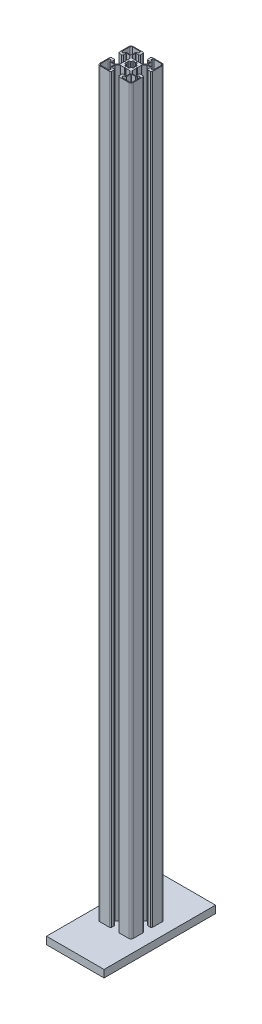
from build123d import *

# Parameters (mm, degrees)
EXTRUDE1_DEPTH      = 1000
SKETCH2_W           = 77.651056684
SKETCH2_H           = 150.32993284
BOSS_EXTRUDE1_DEPTH = 10


with BuildPart() as part:
    # Sketch1 → Extrude1 (new body)
    with BuildSketch(Plane(origin=(0, 0, 0), x_dir=(1, 0, 0), z_dir=(0, 1, 0))):
        with BuildLine():
            Line((4.905816029, 11.21531926), (4.005816103, 10.700171216))
            Line((4.005816103, 10.700171216), (3.105816176, 11.21531926))
            Line((3.105816176, 11.21531926), (-2.197508215, 11.21531926))
            ThreePointArc((-2.197508215, 11.21531926), (-2.342927919, 11.244245037), (-2.466208792, 11.326618683))
            Line((-2.466208792, 11.326618683), (-5.932884474, 14.793294365))
            ThreePointArc((-5.932884474, 14.793294365), (-6.01525812, 14.916575238), (-6.044183897, 15.061994942))
            Line((-6.044183897, 15.061994942), (-6.044183897, 19.35531926))
            ThreePointArc((-6.044183897, 19.35531926), (-5.932884474, 19.624019836), (-5.664183897, 19.73531926))
            Line((-5.664183897, 19.73531926), (-2.579183897, 19.73531926))
            ThreePointArc((-2.579183897, 19.73531926), (-1.50438159, 20.180516952), (-1.059183897, 21.25531926))
            Line((-1.059183897, 21.25531926), (-1.059183897, 24.21531926))
            ThreePointArc((-1.059183897, 24.21531926), (-1.50438159, 25.290121567), (-2.579183897, 25.73531926))
            Line((-2.579183897, 25.73531926), (-15.494183897, 25.73531926))
            ThreePointArc((-15.494183897, 25.73531926), (-17.615504241, 24.856639603), (-18.494183897, 22.73531926))
            Line((-18.494183897, 22.73531926), (-18.494183897, 9.82031926))
            ThreePointArc((-18.494183897, 9.82031926), (-18.048986205, 8.745516952), (-16.974183897, 8.30031926))
            Line((-16.974183897, 8.30031926), (-14.014183897, 8.30031926))
            ThreePointArc((-14.014183897, 8.30031926), (-12.93938159, 8.745516952), (-12.494183897, 9.82031926))
            Line((-12.494183897, 9.82031926), (-12.494183897, 12.90531926))
            ThreePointArc((-12.494183897, 12.90531926), (-12.382884474, 13.174019836), (-12.114183897, 13.28531926))
            Line((-12.114183897, 13.28531926), (-7.813788512, 13.28531926))
            ThreePointArc((-7.813788512, 13.28531926), (-7.668368808, 13.256393482), (-7.545087935, 13.174019836))
            Line((-7.545087935, 13.174019836), (-4.08548332, 9.714415222))
            ThreePointArc((-4.08548332, 9.714415222), (-4.003109675, 9.591134349), (-3.974183897, 9.445714645))
            Line((-3.974183897, 9.445714645), (-3.974183897, 4.135318895))
            Line((-3.974183897, 4.135318895), (-3.454570628, 3.23531926))
            Line((-3.454570628, 3.23531926), (-3.974183897, 2.335319624))
            Line((-3.974183897, 2.335319624), (-3.974183897, -2.968005058))
            ThreePointArc((-3.974183897, -2.968005058), (-4.003109675, -3.113424762), (-4.08548332, -3.236705635))
            Line((-4.08548332, -3.236705635), (-7.552159003, -6.703381317))
            ThreePointArc((-7.552159003, -6.703381317), (-7.675439876, -6.785754963), (-7.82085958, -6.81468074))
            Line((-7.82085958, -6.81468074), (-12.114183897, -6.81468074))
            ThreePointArc((-12.114183897, -6.81468074), (-12.382884474, -6.703381317), (-12.494183897, -6.43468074))
            Line((-12.494183897, -6.43468074), (-12.494183897, -3.34968074))
            ThreePointArc((-12.494183897, -3.34968074), (-12.93938159, -2.274878433), (-14.014183897, -1.82968074))
            Line((-14.014183897, -1.82968074), (-16.974183897, -1.82968074))
            ThreePointArc((-16.974183897, -1.82968074), (-18.048986205, -2.274878433), (-18.494183897, -3.34968074))
            Line((-18.494183897, -3.34968074), (-18.494183897, -16.26468074))
            ThreePointArc((-18.494183897, -16.26468074), (-17.615504241, -18.386001084), (-15.494183897, -19.26468074))
            Line((-15.494183897, -19.26468074), (-2.579183897, -19.26468074))
            ThreePointArc((-2.579183897, -19.26468074), (-1.50438159, -18.819483048), (-1.059183897, -17.74468074))
            Line((-1.059183897, -17.74468074), (-1.059183897, -14.78468074))
            ThreePointArc((-1.059183897, -14.78468074), (-1.50438159, -13.709878433), (-2.579183897, -13.26468074))
            Line((-2.579183897, -13.26468074), (-5.664183897, -13.26468074))
            ThreePointArc((-5.664183897, -13.26468074), (-5.932884474, -13.153381317), (-6.044183897, -12.88468074))
            Line((-6.044183897, -12.88468074), (-6.044183897, -8.584285355))
            ThreePointArc((-6.044183897, -8.584285355), (-6.01525812, -8.438865651), (-5.932884474, -8.315584778))
            Line((-5.932884474, -8.315584778), (-2.473279859, -4.855980164))
            ThreePointArc((-2.473279859, -4.855980164), (-2.349998987, -4.773606518), (-2.204579283, -4.74468074))
            Line((-2.204579283, -4.74468074), (3.105816176, -4.74468074))
            Line((3.105816176, -4.74468074), (4.005816103, -4.229532697))
            Line((4.005816103, -4.229532697), (4.905816029, -4.74468074))
            Line((4.905816029, -4.74468074), (10.20914042, -4.74468074))
            ThreePointArc((10.20914042, -4.74468074), (10.354560124, -4.773606518), (10.477840997, -4.855980164))
            Line((10.477840997, -4.855980164), (13.94451668, -8.322655846))
            ThreePointArc((13.94451668, -8.322655846), (14.026890325, -8.445936719), (14.055816103, -8.591356423))
            Line((14.055816103, -8.591356423), (14.055816103, -12.88468074))
            ThreePointArc((14.055816103, -12.88468074), (13.94451668, -13.153381317), (13.675816103, -13.26468074))
            Line((13.675816103, -13.26468074), (10.590816103, -13.26468074))
            ThreePointArc((10.590816103, -13.26468074), (9.516013795, -13.709878433), (9.070816103, -14.78468074))
            Line((9.070816103, -14.78468074), (9.070816103, -17.74468074))
            ThreePointArc((9.070816103, -17.74468074), (9.516013795, -18.819483048), (10.590816103, -19.26468074))
            Line((10.590816103, -19.26468074), (23.505816103, -19.26468074))
            ThreePointArc((23.505816103, -19.26468074), (25.627136446, -18.386001084), (26.505816103, -16.26468074))
            Line((26.505816103, -16.26468074), (26.505816103, -3.34968074))
            ThreePointArc((26.505816103, -3.34968074), (26.06061841, -2.274878433), (24.985816103, -1.82968074))
            Line((24.985816103, -1.82968074), (22.025816103, -1.82968074))
            ThreePointArc((22.025816103, -1.82968074), (20.951013795, -2.274878433), (20.505816103, -3.34968074))
            Line((20.505816103, -3.34968074), (20.505816103, -6.43468074))
            ThreePointArc((20.505816103, -6.43468074), (20.39451668, -6.703381317), (20.125816103, -6.81468074))
            Line((20.125816103, -6.81468074), (15.825420717, -6.81468074))
            ThreePointArc((15.825420717, -6.81468074), (15.680001013, -6.785754963), (15.556720141, -6.703381317))
            Line((15.556720141, -6.703381317), (12.097115526, -3.243776702))
            ThreePointArc((12.097115526, -3.243776702), (12.01474188, -3.12049583), (11.985816103, -2.975076126))
            Line((11.985816103, -2.975076126), (11.985816103, 2.335319624))
            Line((11.985816103, 2.335319624), (11.466202833, 3.23531926))
            Line((11.466202833, 3.23531926), (11.985816103, 4.135318895))
            Line((11.985816103, 4.135318895), (11.985816103, 9.438643577))
            ThreePointArc((11.985816103, 9.438643577), (12.01474188, 9.584063281), (12.097115526, 9.707344154))
            Line((12.097115526, 9.707344154), (15.563791208, 13.174019836))
            ThreePointArc((15.563791208, 13.174019836), (15.687072081, 13.256393482), (15.832491785, 13.28531926))
            Line((15.832491785, 13.28531926), (20.125816103, 13.28531926))
            ThreePointArc((20.125816103, 13.28531926), (20.39451668, 13.174019836), (20.505816103, 12.90531926))
            Line((20.505816103, 12.90531926), (20.505816103, 9.82031926))
            ThreePointArc((20.505816103, 9.82031926), (20.951013795, 8.745516952), (22.025816103, 8.30031926))
            Line((22.025816103, 8.30031926), (24.985816103, 8.30031926))
            ThreePointArc((24.985816103, 8.30031926), (26.06061841, 8.745516952), (26.505816103, 9.82031926))
            Line((26.505816103, 9.82031926), (26.505816103, 22.73531926))
            ThreePointArc((26.505816103, 22.73531926), (25.627136446, 24.856639603), (23.505816103, 25.73531926))
            Line((23.505816103, 25.73531926), (10.590816103, 25.73531926))
            ThreePointArc((10.590816103, 25.73531926), (9.516013795, 25.290121567), (9.070816103, 24.21531926))
            Line((9.070816103, 24.21531926), (9.070816103, 21.25531926))
            ThreePointArc((9.070816103, 21.25531926), (9.516013795, 20.180516952), (10.590816103, 19.73531926))
            Line((10.590816103, 19.73531926), (13.675816103, 19.73531926))
            ThreePointArc((13.675816103, 19.73531926), (13.94451668, 19.624019836), (14.055816103, 19.35531926))
            Line((14.055816103, 19.35531926), (14.055816103, 15.054923874))
            ThreePointArc((14.055816103, 15.054923874), (14.026890325, 14.90950417), (13.94451668, 14.786223298))
            Line((13.94451668, 14.786223298), (10.484912065, 11.326618683))
            ThreePointArc((10.484912065, 11.326618683), (10.361631192, 11.244245037), (10.216211488, 11.21531926))
            Line((10.216211488, 11.21531926), (4.905816029, 11.21531926))
        make_face()
        with BuildLine():
            Line((13.969837884, 21.274341041), (13.529837884, 21.274341041))
            ThreePointArc((13.529837884, 21.274341041), (12.469177713, 21.713680869), (12.029837884, 22.774341041))
            Line((12.029837884, 22.774341041), (12.029837884, 23.274341041))
            ThreePointArc((12.029837884, 23.274341041), (12.469177713, 24.335001213), (13.529837884, 24.774341041))
            Line((13.529837884, 24.774341041), (23.139837884, 24.774341041))
            ThreePointArc((23.139837884, 24.774341041), (24.752041345, 24.106544502), (25.419837884, 22.494341041))
            Line((25.419837884, 22.494341041), (25.419837884, 12.884341041))
            ThreePointArc((25.419837884, 12.884341041), (24.980498056, 11.823680869), (23.919837884, 11.384341041))
            Line((23.919837884, 11.384341041), (23.419837884, 11.384341041))
            ThreePointArc((23.419837884, 11.384341041), (22.359177713, 11.823680869), (21.919837884, 12.884341041))
            Line((21.919837884, 12.884341041), (21.919837884, 13.324341041))
            ThreePointArc((21.919837884, 13.324341041), (21.626944666, 14.031447822), (20.919837884, 14.324341041))
            Line((20.919837884, 14.324341041), (15.349837884, 14.324341041))
            ThreePointArc((15.349837884, 14.324341041), (15.081137307, 14.435640464), (14.969837884, 14.704341041))
            Line((14.969837884, 14.704341041), (14.969837884, 20.274341041))
            ThreePointArc((14.969837884, 20.274341041), (14.676944666, 20.981447822), (13.969837884, 21.274341041))
        make_face(mode=Mode.SUBTRACT)
        with BuildLine():
            Line((21.958859666, -6.68968074), (21.958859666, -6.24968074))
            ThreePointArc((21.958859666, -6.24968074), (22.398199494, -5.189020569), (23.458859666, -4.74968074))
            Line((23.458859666, -4.74968074), (23.958859666, -4.74968074))
            ThreePointArc((23.958859666, -4.74968074), (25.019519838, -5.189020569), (25.458859666, -6.24968074))
            Line((25.458859666, -6.24968074), (25.458859666, -15.85968074))
            ThreePointArc((25.458859666, -15.85968074), (24.791063127, -17.471884201), (23.178859666, -18.13968074))
            Line((23.178859666, -18.13968074), (13.568859666, -18.13968074))
            ThreePointArc((13.568859666, -18.13968074), (12.508199494, -17.700340912), (12.068859666, -16.63968074))
            Line((12.068859666, -16.63968074), (12.068859666, -16.13968074))
            ThreePointArc((12.068859666, -16.13968074), (12.508199494, -15.079020569), (13.568859666, -14.63968074))
            Line((13.568859666, -14.63968074), (14.008859666, -14.63968074))
            ThreePointArc((14.008859666, -14.63968074), (14.715966447, -14.346787522), (15.008859666, -13.63968074))
            Line((15.008859666, -13.63968074), (15.008859666, -8.06968074))
            ThreePointArc((15.008859666, -8.06968074), (15.120159089, -7.800980164), (15.388859666, -7.68968074))
            Line((15.388859666, -7.68968074), (20.958859666, -7.68968074))
            ThreePointArc((20.958859666, -7.68968074), (21.665966447, -7.396787522), (21.958859666, -6.68968074))
        make_face(mode=Mode.SUBTRACT)
        with BuildLine():
            Line((-6.005162116, -14.678702522), (-5.565162116, -14.678702522))
            ThreePointArc((-5.565162116, -14.678702522), (-4.504501944, -15.11804235), (-4.065162116, -16.178702522))
            Line((-4.065162116, -16.178702522), (-4.065162116, -16.678702522))
            ThreePointArc((-4.065162116, -16.678702522), (-4.504501944, -17.739362694), (-5.565162116, -18.178702522))
            Line((-5.565162116, -18.178702522), (-15.175162116, -18.178702522))
            ThreePointArc((-15.175162116, -18.178702522), (-16.787365577, -17.510905983), (-17.455162116, -15.898702522))
            Line((-17.455162116, -15.898702522), (-17.455162116, -6.288702522))
            ThreePointArc((-17.455162116, -6.288702522), (-17.015822287, -5.22804235), (-15.955162116, -4.788702522))
            Line((-15.955162116, -4.788702522), (-15.455162116, -4.788702522))
            ThreePointArc((-15.455162116, -4.788702522), (-14.394501944, -5.22804235), (-13.955162116, -6.288702522))
            Line((-13.955162116, -6.288702522), (-13.955162116, -6.728702522))
            ThreePointArc((-13.955162116, -6.728702522), (-13.662268897, -7.435809303), (-12.955162116, -7.728702522))
            Line((-12.955162116, -7.728702522), (-7.385162116, -7.728702522))
            ThreePointArc((-7.385162116, -7.728702522), (-7.116461539, -7.840001945), (-7.005162116, -8.108702522))
            Line((-7.005162116, -8.108702522), (-7.005162116, -13.678702522))
            ThreePointArc((-7.005162116, -13.678702522), (-6.712268897, -14.385809303), (-6.005162116, -14.678702522))
        make_face(mode=Mode.SUBTRACT)
        with BuildLine():
            Line((1.828915922, -2.488564034), (1.413170132, -2.316356489))
            ThreePointArc((1.413170132, -2.316356489), (0.823336155, -1.625307126), (1.036269925, -0.742067321))
            ThreePointArc((1.036269925, -0.742067321), (0.446703204, -0.237613869), (-0.057716637, 0.351981608))
            ThreePointArc((-0.057716637, 0.351981608), (-0.940937171, 0.139101897), (-1.631952253, 0.728927667))
            Line((-1.631952253, 0.728927667), (-1.804159798, 1.144673456))
            ThreePointArc((-1.804159798, 1.144673456), (-1.732589712, 2.050394753), (-0.957477943, 2.524372695))
            ThreePointArc((-0.957477943, 2.524372695), (-1.017662114, 3.297961778), (-0.957433843, 4.071547428))
            ThreePointArc((-0.957433843, 4.071547428), (-1.73249376, 4.54554997), (-1.804045409, 5.451241222))
            Line((-1.804045409, 5.451241222), (-1.631837865, 5.866987012))
            ThreePointArc((-1.631837865, 5.866987012), (-0.940788501, 6.456820989), (-0.057548696, 6.243887219))
            ThreePointArc((-0.057548696, 6.243887219), (0.446904755, 6.83345394), (1.036500233, 7.33787378))
            ThreePointArc((1.036500233, 7.33787378), (0.823620522, 8.221094315), (1.413446291, 8.912109397))
            Line((1.413446291, 8.912109397), (1.829192081, 9.084316942))
            ThreePointArc((1.829192081, 9.084316942), (2.734913377, 9.012746856), (3.20889132, 8.237635087))
            ThreePointArc((3.20889132, 8.237635087), (3.982480402, 8.297819258), (4.756066053, 8.237590987))
            ThreePointArc((4.756066053, 8.237590987), (5.230068594, 9.012650904), (6.135759847, 9.084202553))
            Line((6.135759847, 9.084202553), (6.551505636, 8.911995008))
            ThreePointArc((6.551505636, 8.911995008), (7.141339614, 8.220945645), (6.928405843, 7.33770584))
            ThreePointArc((6.928405843, 7.33770584), (7.517972564, 6.833252389), (8.022392405, 6.243656911))
            ThreePointArc((8.022392405, 6.243656911), (8.905612939, 6.456536622), (9.596628022, 5.866710852))
            Line((9.596628022, 5.866710852), (9.768835567, 5.450965063))
            ThreePointArc((9.768835567, 5.450965063), (9.697265481, 4.545243766), (8.922153712, 4.071265824))
            ThreePointArc((8.922153712, 4.071265824), (8.982337882, 3.297676741), (8.922109612, 2.524091091))
            ThreePointArc((8.922109612, 2.524091091), (9.697169528, 2.05008855), (9.768721178, 1.144397297))
            Line((9.768721178, 1.144397297), (9.596513633, 0.728651507))
            ThreePointArc((9.596513633, 0.728651507), (8.90546427, 0.13881753), (8.022224464, 0.351751301))
            ThreePointArc((8.022224464, 0.351751301), (7.517771013, -0.23781542), (6.928175536, -0.742235261))
            ThreePointArc((6.928175536, -0.742235261), (7.141055247, -1.625455795), (6.551229477, -2.316470878))
            Line((6.551229477, -2.316470878), (6.135483688, -2.488678423))
            ThreePointArc((6.135483688, -2.488678423), (5.229762391, -2.417108337), (4.755784449, -1.641996568))
            ThreePointArc((4.755784449, -1.641996568), (3.982195366, -1.702180738), (3.208609716, -1.641952468))
            ThreePointArc((3.208609716, -1.641952468), (2.734607174, -2.417012384), (1.828915922, -2.488564034))
        make_face(mode=Mode.SUBTRACT)
        with BuildLine():
            Line((-13.994183897, 13.28531926), (-13.994183897, 12.84531926))
            ThreePointArc((-13.994183897, 12.84531926), (-14.433523726, 11.784659088), (-15.494183897, 11.34531926))
            Line((-15.494183897, 11.34531926), (-15.994183897, 11.34531926))
            ThreePointArc((-15.994183897, 11.34531926), (-17.054844069, 11.784659088), (-17.494183897, 12.84531926))
            Line((-17.494183897, 12.84531926), (-17.494183897, 22.45531926))
            ThreePointArc((-17.494183897, 22.45531926), (-16.826387358, 24.067522721), (-15.214183897, 24.73531926))
            Line((-15.214183897, 24.73531926), (-5.604183897, 24.73531926))
            ThreePointArc((-5.604183897, 24.73531926), (-4.543523726, 24.295979431), (-4.104183897, 23.23531926))
            Line((-4.104183897, 23.23531926), (-4.104183897, 22.73531926))
            ThreePointArc((-4.104183897, 22.73531926), (-4.543523726, 21.674659088), (-5.604183897, 21.23531926))
            Line((-5.604183897, 21.23531926), (-6.044183897, 21.23531926))
            ThreePointArc((-6.044183897, 21.23531926), (-6.751290679, 20.942426041), (-7.044183897, 20.23531926))
            Line((-7.044183897, 20.23531926), (-7.044183897, 14.66531926))
            ThreePointArc((-7.044183897, 14.66531926), (-7.15548332, 14.396618683), (-7.424183897, 14.28531926))
            Line((-7.424183897, 14.28531926), (-12.994183897, 14.28531926))
            ThreePointArc((-12.994183897, 14.28531926), (-13.701290679, 13.992426041), (-13.994183897, 13.28531926))
        make_face(mode=Mode.SUBTRACT)
    extrude(amount=EXTRUDE1_DEPTH)

    # Sketch2 → Boss-Extrude1 (add)
    with BuildSketch(Plane.XZ):
        with Locations((4.134653114, -3.054432935)):
            Rectangle(SKETCH2_W, SKETCH2_H)
    extrude(amount=BOSS_EXTRUDE1_DEPTH)


solid = part.part
